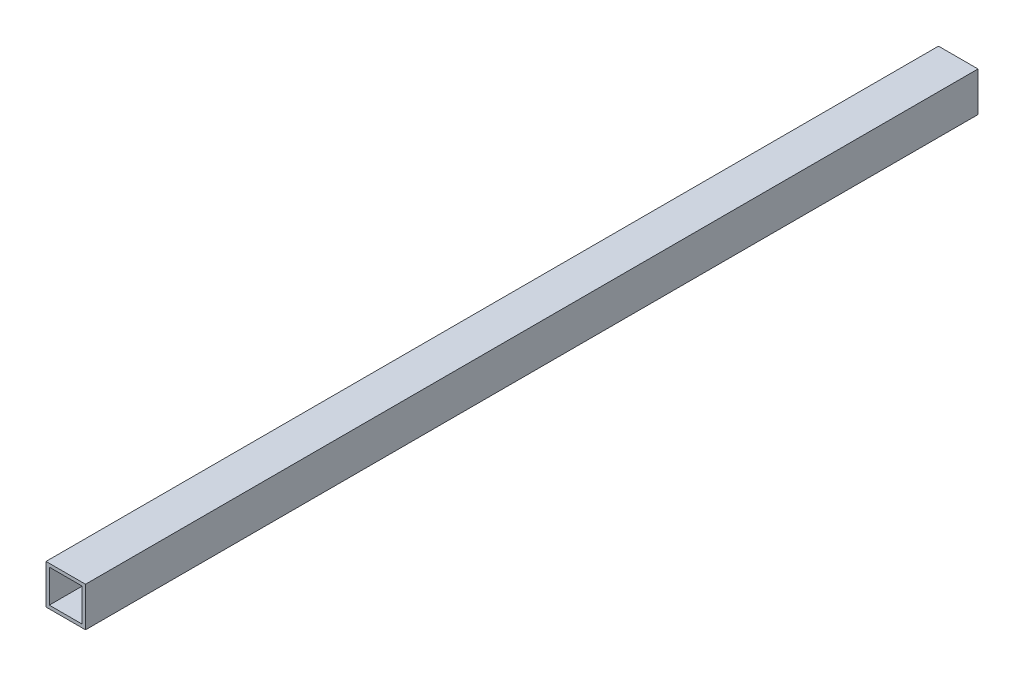
from build123d import *

# Parameters (mm, degrees)
SKETCH_1_W      = 24
SKETCH_1_H      = 24
SKETCH_1_W_2    = 20
SKETCH_1_H_2    = 20
EXTRUDE_1_DEPTH = 542


with BuildPart() as part:
    # 草图1 → 凸台-拉伸1 (new body)
    with BuildSketch(Plane.XY):
        Rectangle(SKETCH_1_W, SKETCH_1_H)
        Rectangle(SKETCH_1_W_2, SKETCH_1_H_2, mode=Mode.SUBTRACT)
    extrude(amount=EXTRUDE_1_DEPTH)


solid = part.part
